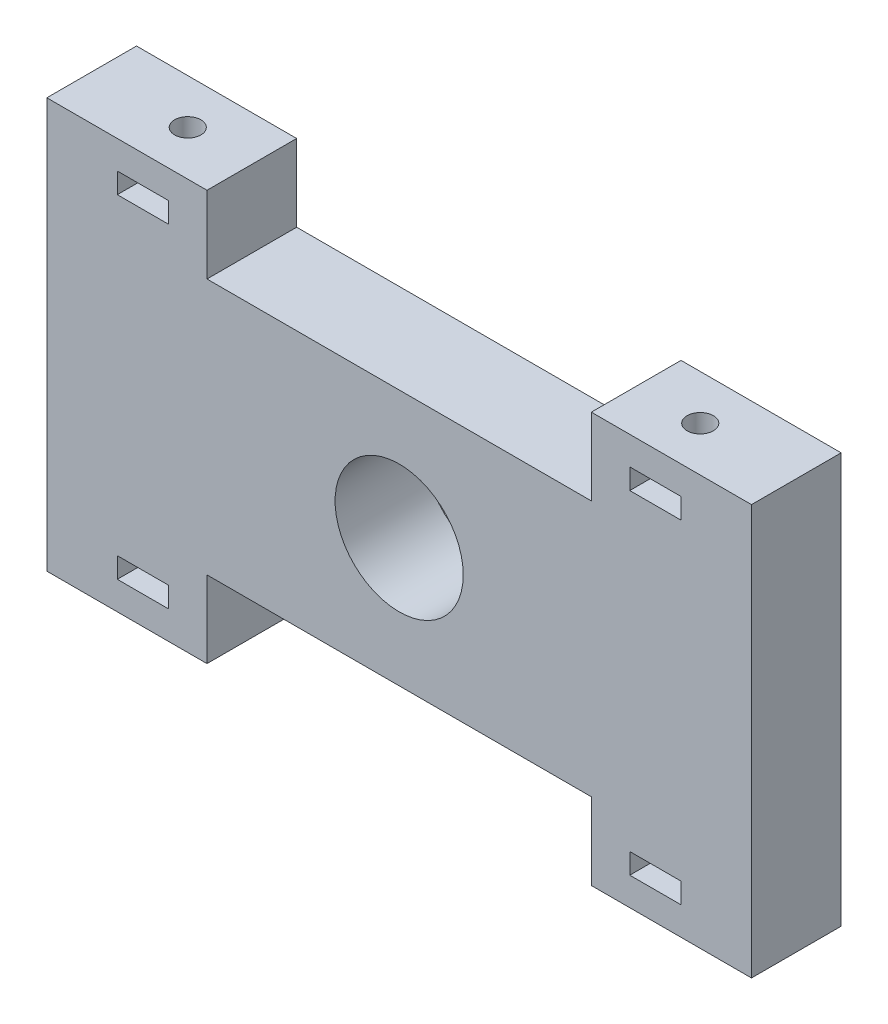
from build123d import *

# Parameters (mm, degrees)
SKETCH_1_R          = 5
EXTRUDE_1_DEPTH     = 7
M2_5X0_45_1_D       = 2.05
CUT_EXTRUDE_1_DEPTH = 0.8
CUT_EXTRUDE_3_DEPTH = 0.8


with BuildPart() as part:
    # 草图1 → 凸台-拉伸1 (new body)
    with BuildSketch(Plane.XY):
        Polygon((-15, 10), (-15, 16), (-27.5, 16), (-27.5, -16), (-15, -16), (-15, -10), (15, -10), (15, -16), (27.5, -16), (27.5, 16), (15, 16), (15, 10), align=None)
        Circle(SKETCH_1_R, mode=Mode.SUBTRACT)
    extrude(amount=EXTRUDE_1_DEPTH)

    # M2.5x0.45 螺纹孔1 (through all)
    with Locations(Plane(origin=(-20, 16, 3.5), x_dir=(0, 0, 1), z_dir=(0, 1, 0))):
        with Locations((0, 0), (0, 40)):
            Hole(M2_5X0_45_1_D / 2)

    # 草图4 → 切除-拉伸1 (cut, symmetric)
    with BuildSketch(Plane(origin=(0, 13, 0), x_dir=(1, 0, 0), z_dir=(0, 1, 0))):
        Polygon((-22, -4.654700538), (-22, -7), (-18, -7), (-18, -4.654700538), (-18, -2.345299462), (-20, -1.190598923), (-22, -2.345299462), align=None)
        Polygon((20, -1.190598923), (18, -2.345299462), (18, -4.654700538), (18, -7), (22, -7), (22, -4.654700538), (22, -2.345299462), align=None)
    extrude(amount=CUT_EXTRUDE_1_DEPTH, both=True, mode=Mode.SUBTRACT)

    # 草图7 → 切除-拉伸3 (cut, symmetric)
    with BuildSketch(Plane(origin=(0, -13, 0), x_dir=(-1, 0, 0), z_dir=(0, -1, 0))):
        Polygon((-22, -4.654700538), (-22, -7), (-18, -7), (-18, -4.654700538), (-18, -2.345299462), (-20, -1.190598923), (-22, -2.345299462), align=None)
        Polygon((20, -1.190598923), (18, -2.345299462), (18, -4.654700538), (18, -7), (22, -7), (22, -4.654700538), (22, -2.345299462), align=None)
    extrude(amount=CUT_EXTRUDE_3_DEPTH, both=True, mode=Mode.SUBTRACT)


solid = part.part
